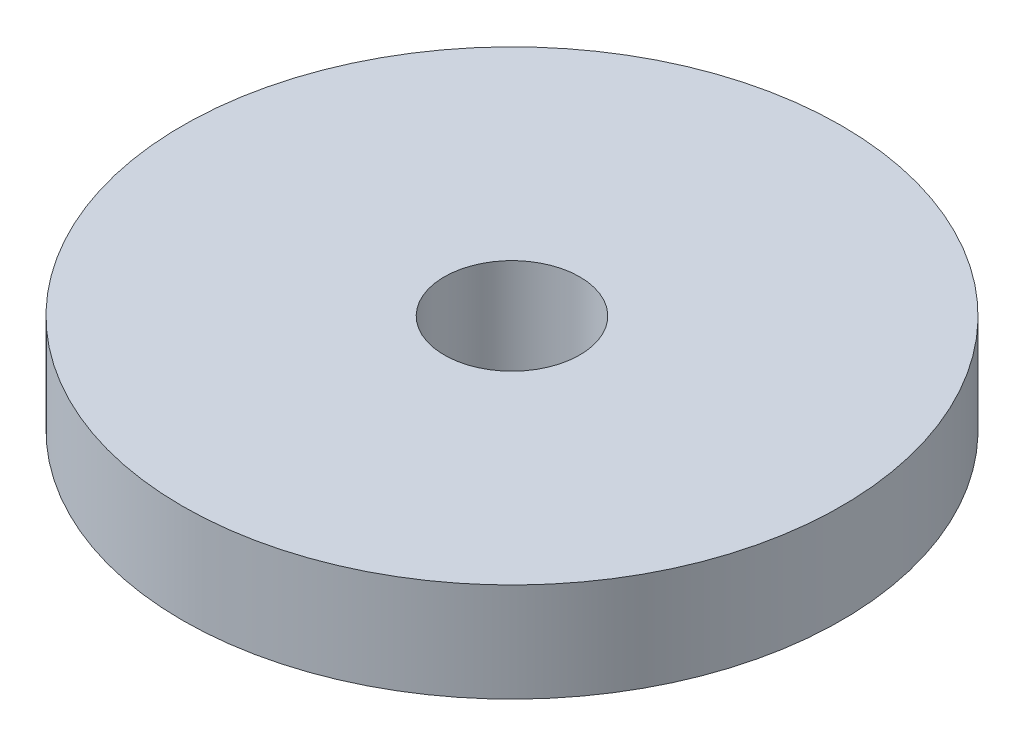
from build123d import *

# Parameters (mm, degrees)
SKETCH1_R           = 15.875
SKETCH1_R_2         = 3.2639
BOSS_EXTRUDE1_DEPTH = 4.7625


with BuildPart() as part:
    # Sketch1 → Boss-Extrude1 (new body)
    with BuildSketch(Plane(origin=(0, 0, 0), x_dir=(1, 0, 0), z_dir=(0, 1, 0))):
        with Locations(Location((0, 0, 0), (0, 0, 90))):
            Circle(SKETCH1_R)
        with Locations(Location((0, 0, 0), (0, 0, 90))):
            Circle(SKETCH1_R_2, mode=Mode.SUBTRACT)
    extrude(amount=BOSS_EXTRUDE1_DEPTH)


solid = part.part
